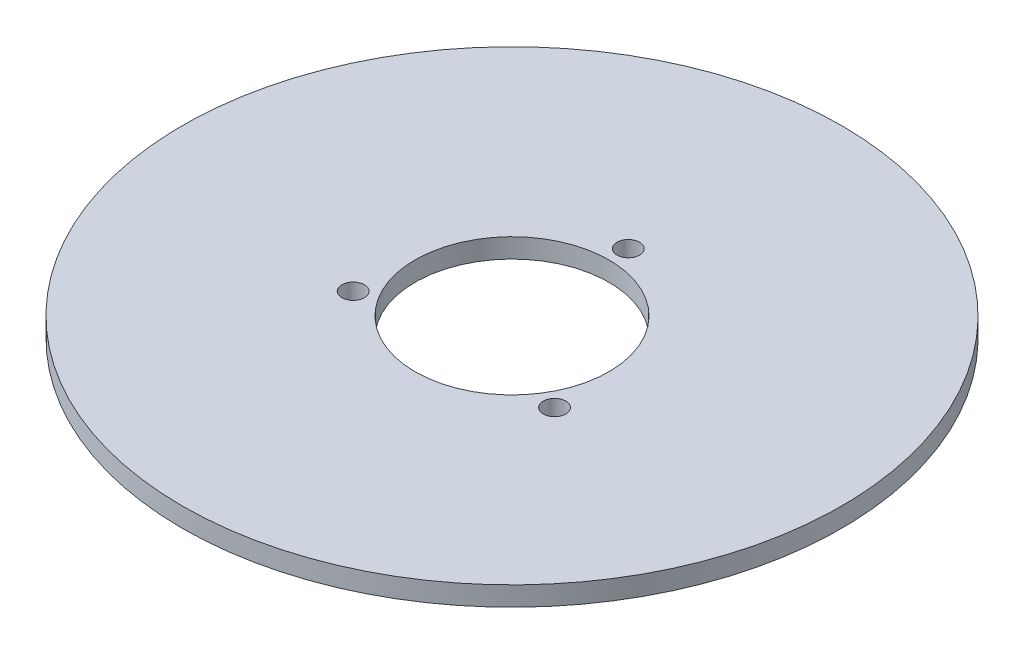
from build123d import *

# Parameters (mm, degrees)
ESBO_O1_R                = 85
ESBO_O1_R_2              = 2.9
ESBO_O1_R_3              = 25
RESSALTO_EXTRUS_O1_DEPTH = 5


with BuildPart() as part:
    # Esboço1 → Ressalto-extrusão1 (new body)
    with BuildSketch(Plane(origin=(0, 0, 0), x_dir=(1, 0, 0), z_dir=(0, 1, 0))):
        with Locations(Location((0, 0, 0), (0, 0, 270))):
            Circle(ESBO_O1_R)
        with Locations(Location((0, 30, 0), (0, 0, 270))):
            Circle(ESBO_O1_R_2, mode=Mode.SUBTRACT)
        with Locations(Location((25.980762114, -15, 0), (0, 0, 270))):
            Circle(ESBO_O1_R_2, mode=Mode.SUBTRACT)
        with Locations(Location((-25.980762114, -15, 0), (0, 0, 270))):
            Circle(ESBO_O1_R_2, mode=Mode.SUBTRACT)
        with Locations(Location((0, 0, 0), (0, 0, 270))):
            Circle(ESBO_O1_R_3, mode=Mode.SUBTRACT)
    extrude(amount=RESSALTO_EXTRUS_O1_DEPTH)


solid = part.part
